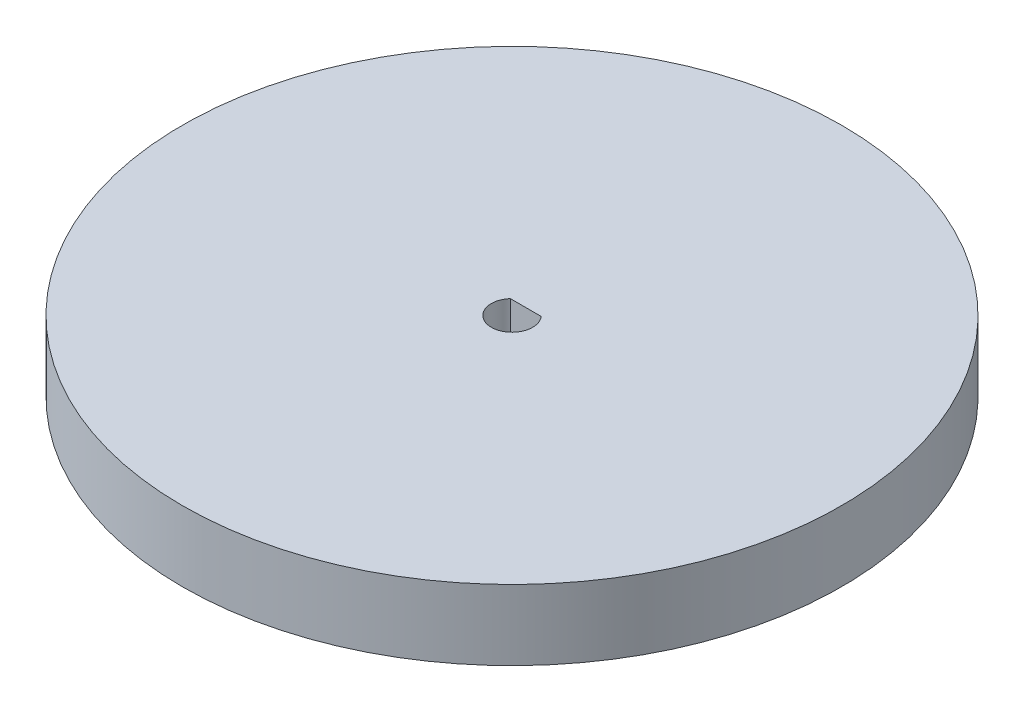
from build123d import *

# Parameters (mm, degrees)
SKETCH1_R           = 23.815610662
BOSS_EXTRUDE1_DEPTH = 5.08
CUT_EXTRUDE1_DEPTH  = 5.08


with BuildPart() as part:
    # Sketch1 → Boss-Extrude1 (new body)
    with BuildSketch(Plane(origin=(0, 0, 0), x_dir=(1, 0, 0), z_dir=(0, 1, 0))):
        with Locations(Location((0, 0, 0), (0, 0, 270))):
            Circle(SKETCH1_R)
    extrude(amount=BOSS_EXTRUDE1_DEPTH)

    # Sketch2 → Cut-Extrude1 (cut)
    with BuildSketch(Plane(origin=(0, 5.08, 0), x_dir=(1, 0, 0), z_dir=(0, 1, 0))):
        with BuildLine():
            Line((-1.114562695, 0.99225), (1.114562695, 0.99225))
            ThreePointArc((1.114562695, 0.99225), (0, -1.49225), (-1.114562695, 0.99225))
        make_face()
    extrude(amount=-CUT_EXTRUDE1_DEPTH, mode=Mode.SUBTRACT)


solid = part.part
